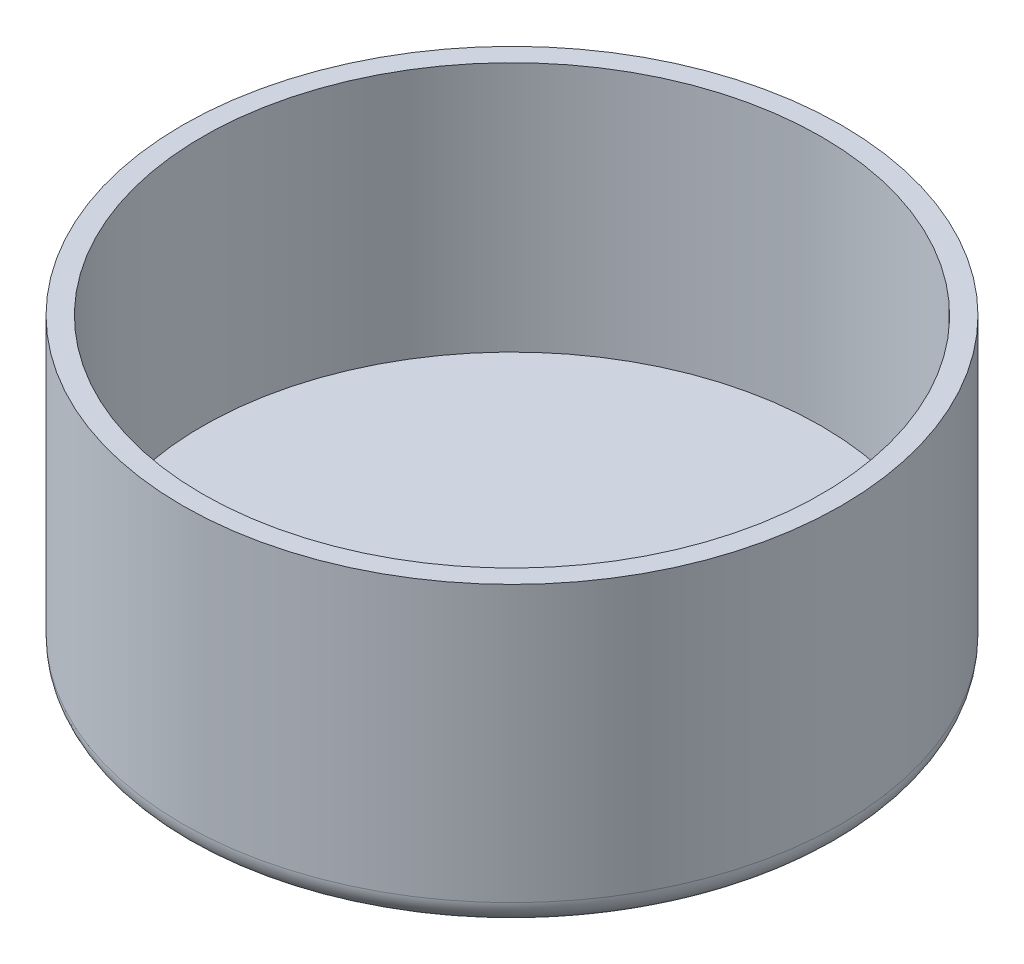
from build123d import *

# Parameters (mm, degrees)
SKETCH1_R           = 13.15
BOSS_EXTRUDE1_DEPTH = 2
SKETCH2_R           = 13.15
SKETCH2_R_2         = 12.35
BOSS_EXTRUDE2_DEPTH = 10
FILLET1_R           = 1


with BuildPart() as part:
    # Sketch1 → Boss-Extrude1 (new body)
    with BuildSketch(Plane(origin=(0, 0, 0), x_dir=(1, 0, 0), z_dir=(0, 1, 0))):
        with Locations(Location((0, 0, 0), (0, 0, 270))):
            Circle(SKETCH1_R)
    extrude(amount=BOSS_EXTRUDE1_DEPTH)

    # Sketch2 → Boss-Extrude2 (add)
    with BuildSketch(Plane(origin=(0, 2, 0), x_dir=(1, 0, 0), z_dir=(0, 1, 0))):
        with Locations(Location((0, 0, 0), (0, 0, 270))):
            Circle(SKETCH2_R)
        with Locations(Location((0, 0, 0), (0, 0, 270))):
            Circle(SKETCH2_R_2, mode=Mode.SUBTRACT)
    extrude(amount=BOSS_EXTRUDE2_DEPTH)

    # Fillet1
    fillet1_edges = [part.edges().sort_by_distance(p)[0] for p in [
        (0, 0, -13.15),
    ]]
    fillet(fillet1_edges, radius=FILLET1_R)


solid = part.part
